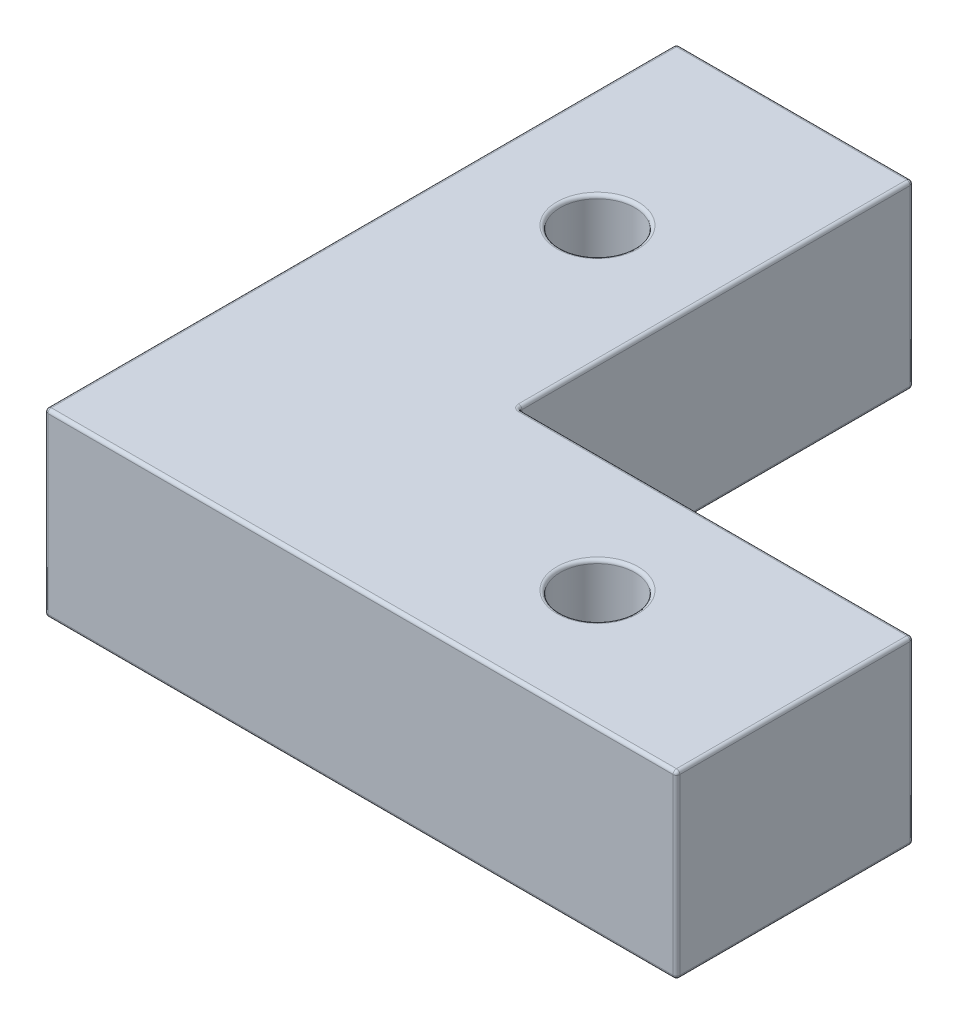
from build123d import *

# Parameters (mm, degrees)
SKETCH1_R           = 2.1
BOSS_EXTRUDE1_DEPTH = 5.08
BOSS_EXTRUDE2_DEPTH = 5.08
FILLET1_R           = 0.1905


with BuildPart() as part:
    # Sketch1 → Boss-Extrude1 (new body)
    with BuildSketch(Plane(origin=(0, 0, 0), x_dir=(1, 0, 0), z_dir=(0, 1, 0))):
        Polygon((0, 0), (35.56, 0), (35.56, 13.335), (13.335, 13.335), (13.335, 35.56), (0, 35.56), align=None)
        with Locations((6.6675, 24.4475)):
            Circle(SKETCH1_R, mode=Mode.SUBTRACT)
        with Locations((24.4475, 6.6675)):
            Circle(SKETCH1_R, mode=Mode.SUBTRACT)
    extrude(amount=BOSS_EXTRUDE1_DEPTH)

    # Sketch1<3> → Boss-Extrude2 (add)
    with BuildSketch(Plane(origin=(0, 0, 0), x_dir=(1, 0, 0), z_dir=(0, 1, 0))):
        Polygon((0, 0), (35.56, 0), (35.56, 13.335), (13.335, 13.335), (13.335, 35.56), (0, 35.56), align=None)
        Polygon((1.524, 34.036), (11.811, 34.036), (11.811, 11.811), (34.036, 11.811), (34.036, 1.524), (1.524, 1.524), align=None, mode=Mode.SUBTRACT)
    extrude(amount=-BOSS_EXTRUDE2_DEPTH)

    # Fillet1
    fillet1_edges = [part.edges().sort_by_distance(p)[0] for p in [
        (4.5675, 5.08, -24.4475),
        (22.3475, 5.08, -6.6675),
        (6.6675, 5.08, -35.56),
        (13.335, 5.08, -24.4475),
        (13.335, 0, -35.56),
        (24.4475, 5.08, -13.335),
        (13.335, 0, -13.335),
        (35.56, 5.08, -6.6675),
        (35.56, 0, -13.335),
        (17.78, 5.08, 0),
        (35.56, 0, 0),
        (0, 5.08, -17.78),
        (0, 0, 0),
        (0, 0, -35.56),
        (0, -5.08, -17.78),
        (17.78, -5.08, 0),
        (35.56, -5.08, -6.6675),
        (24.4475, -5.08, -13.335),
        (13.335, -5.08, -24.4475),
        (6.6675, -5.08, -35.56),
        (6.6675, -5.08, -34.036),
        (11.811, -5.08, -22.9235),
        (22.9235, -5.08, -11.811),
        (34.036, -5.08, -6.6675),
        (17.78, -5.08, -1.524),
        (1.524, -5.08, -17.78),
    ]]
    fillet(fillet1_edges, radius=FILLET1_R)


solid = part.part
